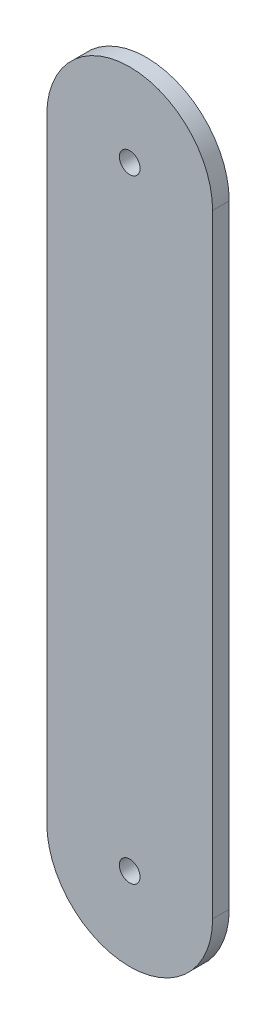
from build123d import *

# Parameters (mm, degrees)
SKETCH_1_R      = 1.25
EXTRUDE_1_DEPTH = 2


with BuildPart() as part:
    # 草圖1 → 填料-伸長1 (new body)
    with BuildSketch(Plane.XY):
        with BuildLine():
            Line((-28.683379048, 37.256823821), (-28.683379048, -36.743176179))
            ThreePointArc((-28.683379048, -36.743176179), (-18.683379048, -46.743176179), (-8.683379048, -36.743176179))
            Line((-8.683379048, -36.743176179), (-8.683379048, 37.256823821))
            ThreePointArc((-8.683379048, 37.256823821), (-18.683379048, 47.256823821), (-28.683379048, 37.256823821))
        make_face()
        with Locations((-18.683379048, 37.256823821)):
            Circle(SKETCH_1_R, mode=Mode.SUBTRACT)
        with Locations((-18.683379048, -36.743176179)):
            Circle(SKETCH_1_R, mode=Mode.SUBTRACT)
    extrude(amount=EXTRUDE_1_DEPTH)


solid = part.part
